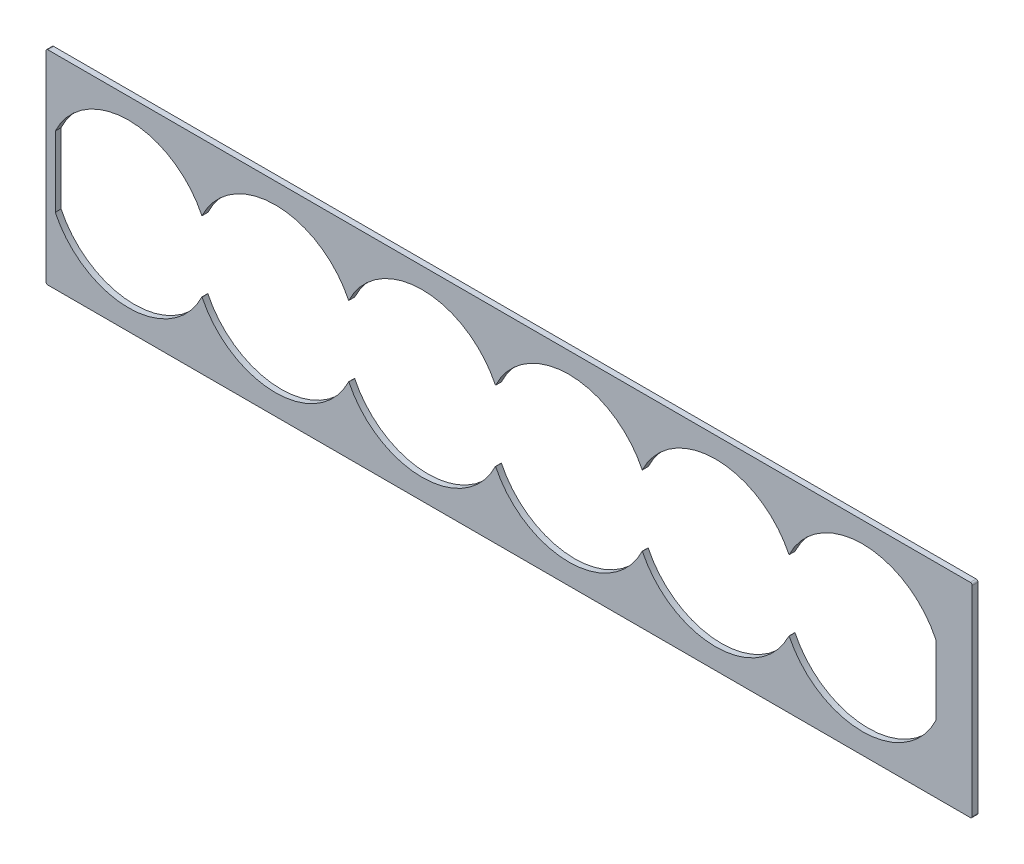
from build123d import *

# Parameters (mm, degrees)
SKETCH4_W                                = 635
SKETCH4_H                                = 139.7
DIMENSIONS_CONTROL_OPTICS_LOCATION_DEPTH = 4
FILLET1_R                                = 1.27


with BuildPart() as part:
    # Sketch4 → DIMENSIONS CONTROL OPTICS LOCATION (new body)
    with BuildSketch(Plane.XY):
        with Locations((317.5, 69.85)):
            Rectangle(SKETCH4_W, SKETCH4_H)
        with BuildLine():
            Line((6.35, 93.996304065), (6.35, 45.703695935))
            ThreePointArc((6.35, 45.703695935), (56.604, 14.096), (106.858, 45.703695935))
            Line((106.858, 45.703695935), (106.985, 45.703695935))
            ThreePointArc((106.985, 45.703695935), (157.239, 14.096), (207.493, 45.703695935))
            Line((207.493, 45.703695935), (207.62, 45.703695935))
            ThreePointArc((207.62, 45.703695935), (257.874, 14.096), (308.128, 45.703695935))
            Line((308.128, 45.703695935), (308.255, 45.703695935))
            ThreePointArc((308.255, 45.703695935), (358.509, 14.096), (408.763, 45.703695935))
            Line((408.763, 45.703695935), (408.89, 45.703695935))
            ThreePointArc((408.89, 45.703695935), (459.144, 14.096), (509.398, 45.703695935))
            Line((509.398, 45.703695935), (509.525, 45.703695935))
            ThreePointArc((509.525, 45.703695935), (559.779, 14.096), (610.033, 45.703695935))
            Line((610.033, 45.703695935), (610.033, 93.996304065))
            ThreePointArc((610.033, 93.996304065), (559.779, 125.604), (509.525, 93.996304065))
            Line((509.525, 93.996304065), (509.398, 93.996304065))
            ThreePointArc((509.398, 93.996304065), (459.144, 125.604), (408.89, 93.996304065))
            Line((408.89, 93.996304065), (408.763, 93.996304065))
            ThreePointArc((408.763, 93.996304065), (358.509, 125.604), (308.255, 93.996304065))
            Line((308.255, 93.996304065), (308.128, 93.996304065))
            ThreePointArc((308.128, 93.996304065), (257.874, 125.604), (207.62, 93.996304065))
            Line((207.62, 93.996304065), (207.493, 93.996304065))
            ThreePointArc((207.493, 93.996304065), (157.239, 125.604), (106.985, 93.996304065))
            Line((106.985, 93.996304065), (106.858, 93.996304065))
            ThreePointArc((106.858, 93.996304065), (56.604, 125.604), (6.35, 93.996304065))
        make_face(mode=Mode.SUBTRACT)
    extrude(amount=DIMENSIONS_CONTROL_OPTICS_LOCATION_DEPTH)

    # Fillet1
    fillet1_edges = [part.edges().sort_by_distance(p)[0] for p in [
        (635, 0, 2),
        (0, 0, 2),
        (0, 139.7, 2),
        (635, 139.7, 2),
    ]]
    fillet(fillet1_edges, radius=FILLET1_R)


solid = part.part
